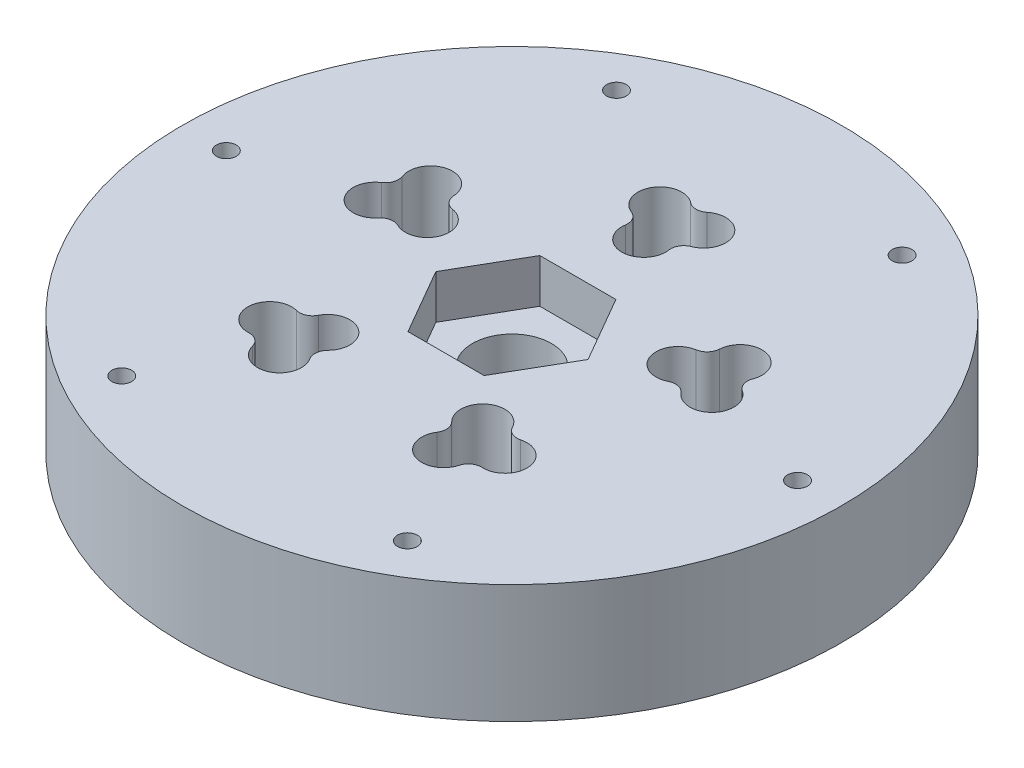
from build123d import *

# Parameters (mm, degrees)
SKETCH1_R                             = 75
BLOCO_DEPTH                           = 27
SKETCH2_R                             = 9
FURO_CENTRAL_18_PASSANTE_DEPTH        = 110.448618082
SKETCH2_3_R                           = 9
ENCAIXE_DO_EIXO_DEPTH                 = 10
REBAIXO_FUROS_DE_FIXA_O_M4_AT_2_COUNT = 2
REBAIXO_FUROS_DE_FIXA_O_M4_AT_2_PITCH = 65
REBAIXO_FUROS_DE_FIXA_O_M4_AT_3_COUNT = 2
REBAIXO_FUROS_DE_FIXA_O_M4_AT_3_PITCH = 112.583302492
REBAIXO_FUROS_DE_FIXA_O_M4_AT_4_COUNT = 2
REBAIXO_FUROS_DE_FIXA_O_M4_AT_4_PITCH = 130
REBAIXO_FUROS_DE_FIXA_O_M4_AT_5_COUNT = 2
REBAIXO_FUROS_DE_FIXA_O_M4_AT_5_PITCH = 112.583302492
REBAIXO_FUROS_DE_FIXA_O_M4_AT_6_COUNT = 2
REBAIXO_FUROS_DE_FIXA_O_M4_AT_6_PITCH = 65
RASGO_DIMENSIONADO_DEPTH              = 110.448618082
RASGOS_COUNT                          = 5
SKETCH7_R                             = 4


with BuildPart() as part:
    # Sketch1 → Bloco (new body)
    with BuildSketch(Plane(origin=(0, 0, 0), x_dir=(1, 0, 0), z_dir=(0, 1, 0))):
        Circle(SKETCH1_R)
    extrude(amount=-BLOCO_DEPTH)

    # Sketch2 → Furo Central - Ø18 Passante (cut, through all)
    with BuildSketch(Plane(origin=(0, 0, 0), x_dir=(-1, 0, 0), z_dir=(0, 1, 0))):
        Circle(SKETCH2_R)
    extrude(amount=-FURO_CENTRAL_18_PASSANTE_DEPTH, mode=Mode.SUBTRACT)

    # Sketch2<3> → Encaixe do Eixo (cut)
    with BuildSketch(Plane(origin=(0, 0, 0), x_dir=(-1, 0, 0), z_dir=(0, 1, 0))):
        Polygon((-8.660254038, 15), (-17.320508076, 0), (-8.660254038, -15), (8.660254038, -15), (17.320508076, 0), (8.660254038, 15), align=None)
        Circle(SKETCH2_3_R, mode=Mode.SUBTRACT)
    extrude(amount=-ENCAIXE_DO_EIXO_DEPTH, mode=Mode.SUBTRACT)

    # Sketch5 → Rebaixo - Furos de Fixação M4 (revolve, cut)
    with BuildSketch(Plane(origin=(32.5, -27, -56.291651246), x_dir=(0, 0, -1), z_dir=(1, 0, 0))):
        Polygon((0, 0), (0, 27), (2.25, 27), (2.25, 4), (4, 4), (4, 0.025), (4.025, 0), align=None)
    rebaixo_furos_de_fixa_o_m4 = revolve(axis=Axis((32.5, -33.35, -56.291651246), (0, 1, 0)), mode=Mode.SUBTRACT)

    # Rebaixo - Furos de Fixação M4 at 2: Rebaixo - Furos de Fixação M4 ×2
    with Locations(*[(-i * REBAIXO_FUROS_DE_FIXA_O_M4_AT_2_PITCH, 0, 0) for i in range(1, REBAIXO_FUROS_DE_FIXA_O_M4_AT_2_COUNT)]):
        add(rebaixo_furos_de_fixa_o_m4, mode=Mode.SUBTRACT)

    # Rebaixo - Furos de Fixação M4 at 3: Rebaixo - Furos de Fixação M4 ×2
    with Locations(*[Vector(-0.866025403784438, 0, 0.5000000000000011) * (i * REBAIXO_FUROS_DE_FIXA_O_M4_AT_3_PITCH) for i in range(1, REBAIXO_FUROS_DE_FIXA_O_M4_AT_3_COUNT)]):
        add(rebaixo_furos_de_fixa_o_m4, mode=Mode.SUBTRACT)

    # Rebaixo - Furos de Fixação M4 at 4: Rebaixo - Furos de Fixação M4 ×2
    with Locations(*[Vector(-0.4999999999999989, 0, 0.8660254037844394) * (i * REBAIXO_FUROS_DE_FIXA_O_M4_AT_4_PITCH) for i in range(1, REBAIXO_FUROS_DE_FIXA_O_M4_AT_4_COUNT)]):
        add(rebaixo_furos_de_fixa_o_m4, mode=Mode.SUBTRACT)

    # Rebaixo - Furos de Fixação M4 at 5: Rebaixo - Furos de Fixação M4 ×2
    with Locations(*[(0, 0, i * REBAIXO_FUROS_DE_FIXA_O_M4_AT_5_PITCH) for i in range(1, REBAIXO_FUROS_DE_FIXA_O_M4_AT_5_COUNT)]):
        add(rebaixo_furos_de_fixa_o_m4, mode=Mode.SUBTRACT)

    # Rebaixo - Furos de Fixação M4 at 6: Rebaixo - Furos de Fixação M4 ×2
    with Locations(*[Vector(0.5000000000000009, 0, 0.8660254037844382) * (i * REBAIXO_FUROS_DE_FIXA_O_M4_AT_6_PITCH) for i in range(1, REBAIXO_FUROS_DE_FIXA_O_M4_AT_6_COUNT)]):
        add(rebaixo_furos_de_fixa_o_m4, mode=Mode.SUBTRACT)

    # Sketch6 → Rasgo Dimensionado (cut, through all)
    with BuildSketch(Plane(origin=(0, -27, 0), x_dir=(-1, 0, 0), z_dir=(0, -1, 0))):
        with BuildLine():
            ThreePointArc((-4.942704321, 30.754767512), (0, 25), (4.942704321, 30.754767512))
            ThreePointArc((4.942704321, 30.754767512), (5.310250702, 32.70762802), (6.817704321, 34.002362777))
            ThreePointArc((6.817704321, 34.002362777), (9.330127019, 41.160254038), (1.875, 42.563377787))
            ThreePointArc((1.875, 42.563377787), (0, 41.905252036), (-1.875, 42.563377787))
            ThreePointArc((-1.875, 42.563377787), (-9.330127019, 41.160254038), (-6.817704321, 34.002362777))
            ThreePointArc((-6.817704321, 34.002362777), (-5.310250702, 32.70762802), (-4.942704321, 30.754767512))
        make_face()
    rasgo_dimensionado = extrude(amount=-RASGO_DIMENSIONADO_DEPTH, mode=Mode.SUBTRACT)

    # Rasgos: Rasgo Dimensionado ×5 about axis
    rasgos_axis = Axis((0, -27, 0), (0, 1, 0))
    for i in range(1, RASGOS_COUNT):
        add(rasgo_dimensionado.rotate(rasgos_axis, i * 360 / RASGOS_COUNT), mode=Mode.SUBTRACT)

    # Sketch7 → Canal - Raio de 4mm (revolve, cut)
    with BuildSketch(Plane(origin=(0, 0, 0), x_dir=(0, 0, -1), z_dir=(1, 0, 0))):
        with Locations((-53.5, -27)):
            Circle(SKETCH7_R)
    revolve(axis=Axis((0, -27, 0), (0, 1, 0)), mode=Mode.SUBTRACT)


solid = part.part
